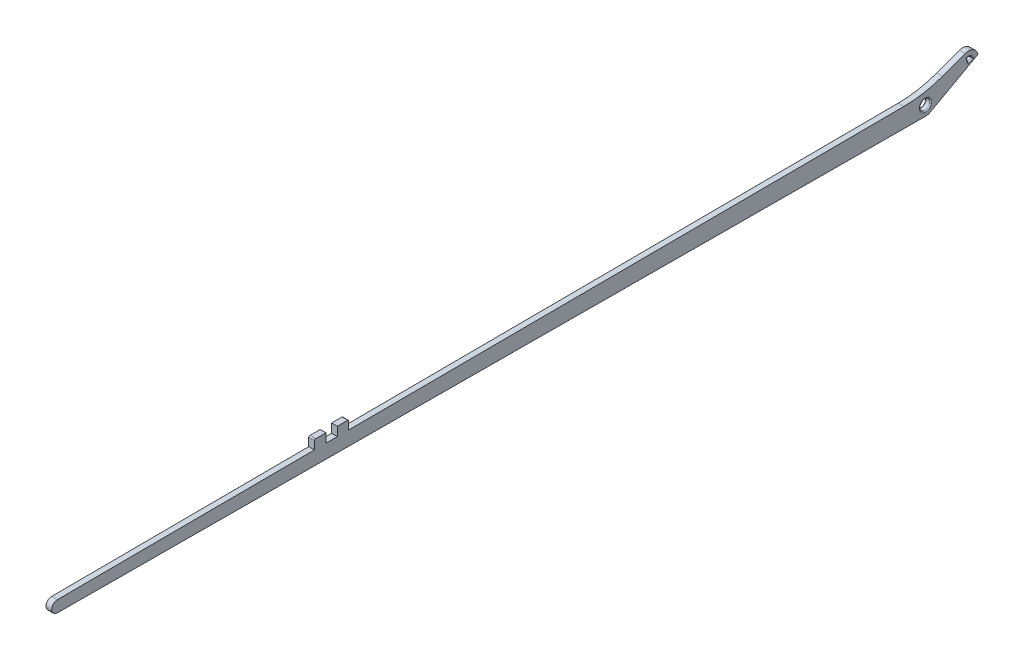
from build123d import *

# Parameters (mm, degrees)
SKETCH_1_R      = 2.25
EXTRUDE_1_DEPTH = 2.5
FILLET_1_R      = 0.5


with BuildPart() as part:
    # Эскиз1 → Бобышка-Вытянуть1 (new body)
    with BuildSketch(Plane(origin=(0, 0, 0), x_dir=(0, 0, -1), z_dir=(1, 0, 0))):
        with BuildLine():
            ThreePointArc((22.943818195, 7.757072943), (20.83949046, 10.565703525), (17.340266807, 10.834096505))
            Line((17.340266807, 10.834096505), (7.414281192, 7.221333195))
            ThreePointArc((7.414281192, 7.221333195), (-0.89095562, 4.985699873), (-9.456459328, 4.206494465))
            Line((-9.456459328, 4.206494465), (-252.5, 3.087186175))
            Line((-252.5, 3.087186175), (-252.5, 7))
            Line((-252.5, 7), (-257.5, 7))
            Line((-257.5, 7), (-257.5, 3.064159266))
            Line((-257.5, 3.064159266), (-262.5, 3.041132357))
            Line((-262.5, 3.041132357), (-262.5, 7))
            Line((-262.5, 7), (-267.5, 7))
            Line((-267.5, 7), (-267.5, 3.018105448))
            Line((-267.5, 3.018105448), (-380, 2.5))
            ThreePointArc((-380, 2.5), (-382.5, 0), (-380, -2.5))
            Line((-380, -2.5), (-0.019572665, -4.24995493))
            ThreePointArc((-0.019572665, -4.24995493), (1.046958504, -4.119026328), (2.046563679, -3.724792223))
            Line((2.046563679, -3.724792223), (22.943818195, 7.757072943))
        make_face()
        with BuildLine():
            Line((18.793852416, 6.840402867), (18.161115151, 8.578834215))
            ThreePointArc((18.161115151, 8.578834215), (19.5756962, 8.517072273), (20.532283764, 7.473140132))
            Line((20.532283764, 7.473140132), (18.793852416, 6.840402867))
        make_face(mode=Mode.SUBTRACT)
        Circle(SKETCH_1_R, mode=Mode.SUBTRACT)
    extrude(amount=EXTRUDE_1_DEPTH)

    # Скругление1
    fillet_1_edges = [part.edges().sort_by_distance(p)[0] for p in [
        (2.5, 0, 2.25),
        (2.5, 7.156771499, -19.66306809),
        (2.5, 7.709618541, -18.477483783),
        (0, 0, 2.25),
        (0, 7.709618541, -18.477483783),
        (0, 7.156771499, -19.66306809),
        (0, 8.517072273, -19.5756962),
        (1.25, 7, 267.5),
        (1.25, 7, 252.5),
        (2.5, 8.517072273, -19.5756962),
    ]]
    fillet(fillet_1_edges, radius=FILLET_1_R)


solid = part.part
